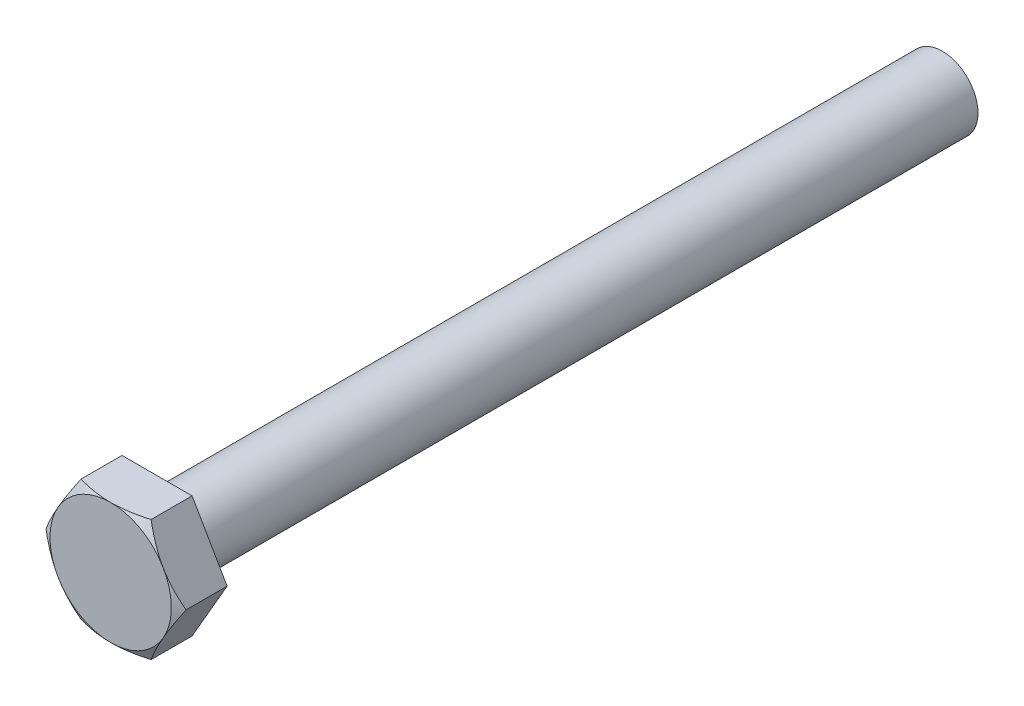
from build123d import *

# Parameters (mm, degrees)
SKETCH1_R           = 10
BOSS_EXTRUDE1_DEPTH = 110
BOSS_EXTRUDE2_DEPTH = 13
SKETCH3_OUTSIDE_W   = 134.036
SKETCH3_OUTSIDE_H   = 128.776
SKETCH3_OUTSIDE_R   = 17
CUT_EXTRUDE1_DEPTH  = 13
CUT_EXTRUDE1_DRAFT  = -60


with BuildPart() as part:
    # Sketch1 → Boss-Extrude1 (new, symmetric)
    with BuildSketch(Plane.XY):
        Circle(SKETCH1_R)
    extrude(amount=BOSS_EXTRUDE1_DEPTH, both=True)

    # Sketch2 → Boss-Extrude2 (add)
    with BuildSketch(Plane.XY.offset(110)):
        Polygon((-19.629909152, 0), (-9.814954576, -17), (9.814954576, -17), (19.629909152, 0), (9.814954576, 17), (-9.814954576, 17), align=None)
    extrude(amount=BOSS_EXTRUDE2_DEPTH)


with BuildPart() as cut_extrude1_tool:
    # Sketch3 outside → Cut-Extrude1 (with draft: the straight prism first)
    with BuildSketch(Plane.XY.offset(123)):
        Rectangle(SKETCH3_OUTSIDE_W, SKETCH3_OUTSIDE_H)
        Circle(SKETCH3_OUTSIDE_R, mode=Mode.SUBTRACT)
    extrude(amount=-CUT_EXTRUDE1_DEPTH)
    # Cut-Extrude1: the draft: its side faces are tilted about the plane it starts from
    cut_extrude1_sides = [cut_extrude1_tool.faces().sort_by_distance(p)[0] for p in [
        (0, -64.388, 116.5),
        (67.018, 0, 116.5),
        (0, 64.388, 116.5),
        (-67.018, 0, 116.5),
        (-17, 0, 116.5),
    ]]
    draft(cut_extrude1_sides, Plane.XY.offset(123), CUT_EXTRUDE1_DRAFT)


with BuildPart() as part_1:
    add(part.part)

    # Cut-Extrude1: cut by cut_extrude1_tool
    add(cut_extrude1_tool.part, mode=Mode.SUBTRACT)


solid = part_1.part
